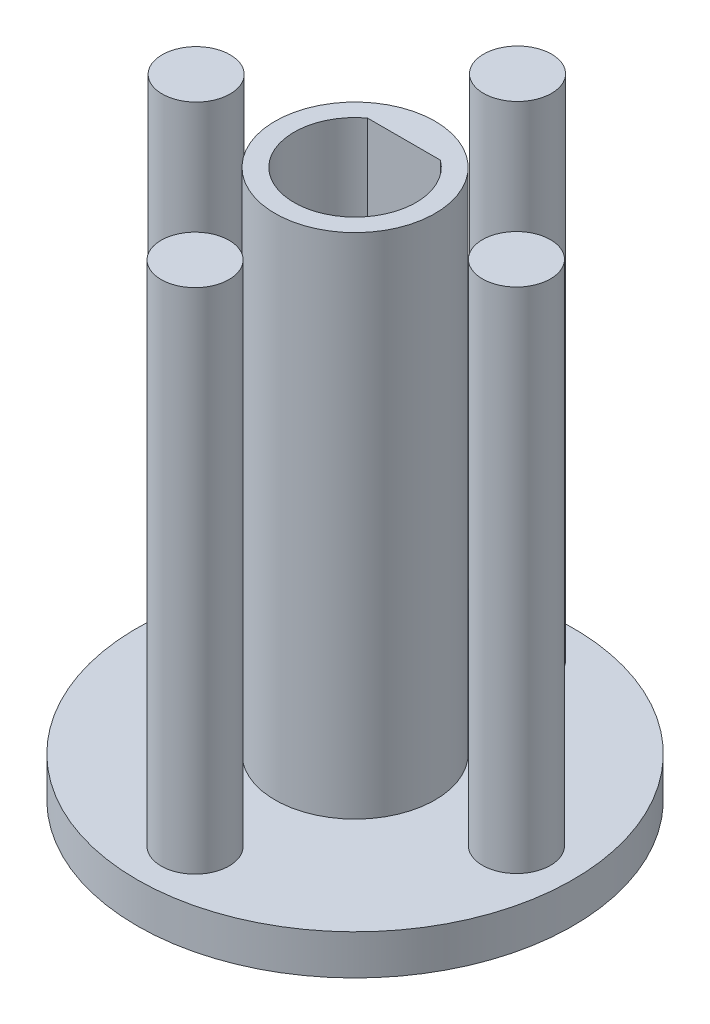
from build123d import *

# Parameters (mm, degrees)
SKETCH3_R             = 1.7
BOSS_EXTRUDE1_DEPTH   = 27.4
BOSS_EXTRUDE1_2_DEPTH = 27.4
BOSS_EXTRUDE1_3_DEPTH = 27.4
BOSS_EXTRUDE1_4_DEPTH = 27.4
SKETCH3_R_2           = 4
BOSS_EXTRUDE1_5_DEPTH = 27.4
SKETCH3_17_R          = 10.9
BOSS_EXTRUDE2_DEPTH   = 2


with BuildPart() as part:
    # Sketch3 → Boss-Extrude1 (new body)
    with BuildSketch(Plane(origin=(0, 0, 0), x_dir=(1, 0, 0), z_dir=(0, 1, 0))):
        with Locations(Location((0.009034474, 8.115584077, 0), (0, 0, 90))):
            Circle(SKETCH3_R)
    extrude(amount=BOSS_EXTRUDE1_DEPTH)



with BuildPart() as body_2:
    # Sketch3 → Boss-Extrude1 2 (new body)
    with BuildSketch(Plane(origin=(0, 0, 0), x_dir=(1, 0, 0), z_dir=(0, 1, 0))):
        with Locations(Location((8.017679827, 0.053335715, 0), (0, 0, 90))):
            Circle(SKETCH3_R)
    extrude(amount=BOSS_EXTRUDE1_2_DEPTH)


with BuildPart() as body_3:
    # Sketch3 → Boss-Extrude1 3 (new body)
    with BuildSketch(Plane(origin=(0, 0, 0), x_dir=(1, 0, 0), z_dir=(0, 1, 0))):
        with Locations(Location((0.009179949, -8.009057152, 0), (0, 0, 90))):
            Circle(SKETCH3_R)
    extrude(amount=BOSS_EXTRUDE1_3_DEPTH)


with BuildPart() as body_4:
    # Sketch3 → Boss-Extrude1 4 (new body)
    with BuildSketch(Plane(origin=(0, 0, 0), x_dir=(1, 0, 0), z_dir=(0, 1, 0))):
        with Locations(Location((-7.999465404, 0.05319121, 0), (0, 0, 90))):
            Circle(SKETCH3_R)
    extrude(amount=BOSS_EXTRUDE1_4_DEPTH)


with BuildPart() as body_5:
    # Sketch3 → Boss-Extrude1 5 (new body)
    with BuildSketch(Plane(origin=(0, 0, 0), x_dir=(1, 0, 0), z_dir=(0, 1, 0))):
        with Locations(Location((0, 0, 0), (0, 0, 90))):
            Circle(SKETCH3_R_2)
        with BuildLine():
            Line((-1.823098343, 2.445161023), (1.823098343, 2.445161023))
            ThreePointArc((1.823098343, 2.445161023), (0, -3.05), (-1.823098343, 2.445161023))
        make_face(mode=Mode.SUBTRACT)
    extrude(amount=BOSS_EXTRUDE1_5_DEPTH)


with BuildPart() as part_1:
    add(part.part)

    add(body_2.part)  # Boss-Extrude2 merges body 2

    add(body_3.part)  # Boss-Extrude2 merges body 3

    add(body_4.part)  # Boss-Extrude2 merges body 4

    add(body_5.part)  # Boss-Extrude2 merges body 5
    # Sketch3<17> → Boss-Extrude2 (add)
    with BuildSketch(Plane(origin=(0, 0, 0), x_dir=(1, 0, 0), z_dir=(0, 1, 0))):
        with Locations(Location((0, 0, 0), (0, 0, 270))):
            Circle(SKETCH3_17_R)
    extrude(amount=BOSS_EXTRUDE2_DEPTH)


solid = part_1.part
